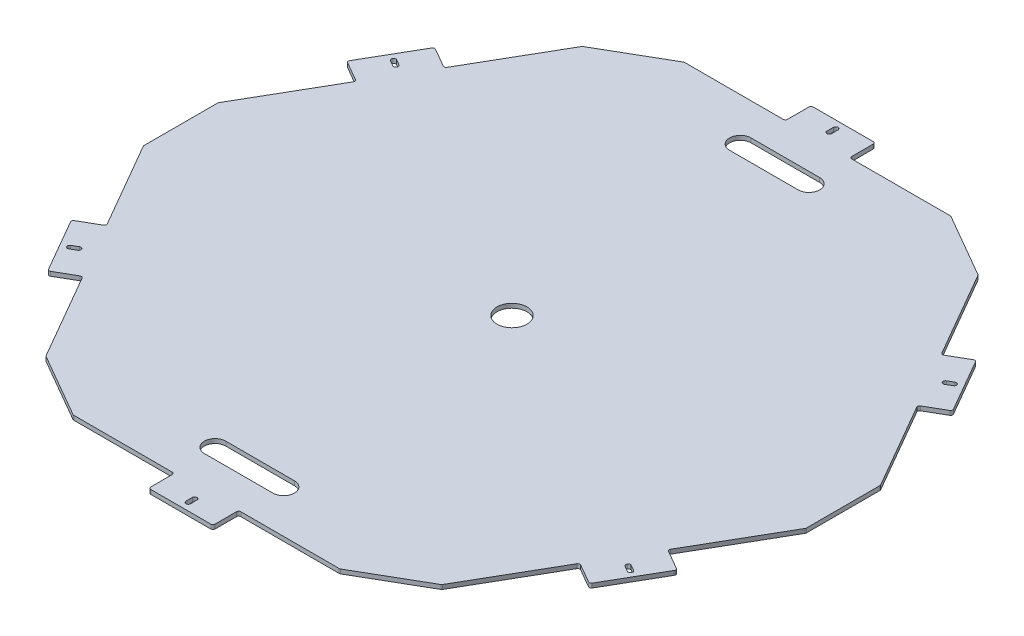
from build123d import *

# Parameters (mm, degrees)
BOSS_EXTRUDE1_DEPTH = 6.35
SKETCH2_R           = 22.225
CUT_EXTRUDE1_DEPTH  = 6.35
FILLET2_R           = 3.175


with BuildPart() as part:
    # Sketch1 → Boss-Extrude1 (new body)
    with BuildSketch(Plane(origin=(0, 0, 0), x_dir=(1, 0, 0), z_dir=(0, 1, 0))):
        Polygon((359.098373018, -359.098373018), (490.5375, -131.439126982), (490.5375, 131.439126982), (359.098373018, 359.098373018), (131.439126982, 490.5375), (-131.439126982, 490.5375), (-359.098373018, 359.098373018), (-490.5375, 131.439126982), (-490.5375, -131.439126982), (-359.098373018, -359.098373018), (-131.439126982, -490.5375), (131.439126982, -490.5375), align=None)
    extrude(amount=BOSS_EXTRUDE1_DEPTH)

    # Sketch2 → Cut-Extrude1 (cut)
    with BuildSketch(Plane(origin=(0, 6.35, 0), x_dir=(1, 0, 0), z_dir=(0, 1, 0))):
        with Locations(Location((0, 0, 0), (0, 0, 270))):
            Circle(SKETCH2_R)
        Polygon((-131.439126982, 490.5375), (-197.430262751, 452.4375), (-47.625, 452.4375), (-47.625, 490.5375), align=None)
        Polygon((131.439126982, 490.5375), (47.625, 490.5375), (47.625, 452.4375), (197.430262751, 452.4375), align=None)
        with BuildLine():
            Line((3.3734375, 479.425), (3.3734375, 469.9))
            ThreePointArc((3.3734375, 469.9), (0, 466.5265625), (-3.3734375, 469.9))
            Line((-3.3734375, 469.9), (-3.3734375, 479.425))
            ThreePointArc((-3.3734375, 479.425), (0, 482.7984375), (3.3734375, 479.425))
        make_face()
        with BuildLine():
            Line((-50.8, 404.8125), (50.8, 404.8125))
            ThreePointArc((50.8, 404.8125), (66.675, 388.9375), (50.8, 373.0625))
            Line((50.8, 373.0625), (-50.8, 373.0625))
            ThreePointArc((-50.8, 373.0625), (-66.675, 388.9375), (-50.8, 404.8125))
        make_face()
        Polygon((401.005436509, 286.513209855), (359.098373018, 359.098373018), (293.107237249, 397.198373018), (368.009868625, 267.463209855), align=None)
        Polygon((490.5375, 55.239126982), (490.5375, 131.439126982), (448.630436509, 204.024290145), (415.634868625, 184.974290145), align=None)
        Polygon((448.630436509, -204.024290145), (490.5375, -131.439126982), (490.5375, -55.239126982), (415.634868625, -184.974290145), align=None)
        Polygon((293.107237249, -397.198373018), (359.098373018, -359.098373018), (401.005436509, -286.513209855), (368.009868625, -267.463209855), align=None)
        Polygon((47.625, -490.5375), (131.439126982, -490.5375), (197.430262751, -452.4375), (47.625, -452.4375), align=None)
        Polygon((-197.430262751, -452.4375), (-131.439126982, -490.5375), (-47.625, -490.5375), (-47.625, -452.4375), align=None)
        Polygon((-401.005436509, -286.513209855), (-359.098373018, -359.098373018), (-293.107237249, -397.198373018), (-368.009868625, -267.463209855), align=None)
        Polygon((-490.5375, -55.239126982), (-490.5375, -131.439126982), (-448.630436509, -204.024290145), (-415.634868625, -184.974290145), align=None)
        Polygon((-448.630436509, 204.024290145), (-490.5375, 131.439126982), (-490.5375, 55.239126982), (-415.634868625, 184.974290145), align=None)
        Polygon((-293.107237249, 397.198373018), (-359.098373018, 359.098373018), (-401.005436509, 286.513209855), (-368.009868625, 267.463209855), align=None)
        with BuildLine():
            Line((-413.507510459, 242.633982573), (-405.258618488, 237.871482573))
            ThreePointArc((-405.258618488, 237.871482573), (-404.023854665, 233.26328125), (-408.632055988, 232.028517427))
            Line((-408.632055988, 232.028517427), (-416.880947959, 236.791017427))
            ThreePointArc((-416.880947959, 236.791017427), (-418.115711782, 241.39921875), (-413.507510459, 242.633982573))
        make_face()
        with BuildLine():
            Line((416.880947959, 236.791017427), (408.632055988, 232.028517427))
            ThreePointArc((408.632055988, 232.028517427), (404.023854665, 233.26328125), (405.258618488, 237.871482573))
            Line((405.258618488, 237.871482573), (413.507510459, 242.633982573))
            ThreePointArc((413.507510459, 242.633982573), (418.115711782, 241.39921875), (416.880947959, 236.791017427))
        make_face()
        with BuildLine():
            Line((416.880947959, -236.791017427), (408.632055988, -232.028517427))
            ThreePointArc((408.632055988, -232.028517427), (404.023854665, -233.26328125), (405.258618488, -237.871482573))
            Line((405.258618488, -237.871482573), (413.507510459, -242.633982573))
            ThreePointArc((413.507510459, -242.633982573), (418.115711782, -241.39921875), (416.880947959, -236.791017427))
        make_face()
        with BuildLine():
            Line((-50.8, -404.8125), (50.8, -404.8125))
            ThreePointArc((50.8, -404.8125), (66.675, -388.9375), (50.8, -373.0625))
            Line((50.8, -373.0625), (-50.8, -373.0625))
            ThreePointArc((-50.8, -373.0625), (-66.675, -388.9375), (-50.8, -404.8125))
        make_face()
        with BuildLine():
            Line((3.3734375, -479.425), (3.3734375, -469.9))
            ThreePointArc((3.3734375, -469.9), (0, -466.5265625), (-3.3734375, -469.9))
            Line((-3.3734375, -469.9), (-3.3734375, -479.425))
            ThreePointArc((-3.3734375, -479.425), (0, -482.7984375), (3.3734375, -479.425))
        make_face()
        with BuildLine():
            Line((-413.507510459, -242.633982573), (-405.258618488, -237.871482573))
            ThreePointArc((-405.258618488, -237.871482573), (-404.023854665, -233.26328125), (-408.632055988, -232.028517427))
            Line((-408.632055988, -232.028517427), (-416.880947959, -236.791017427))
            ThreePointArc((-416.880947959, -236.791017427), (-418.115711782, -241.39921875), (-413.507510459, -242.633982573))
        make_face()
    extrude(amount=-CUT_EXTRUDE1_DEPTH, mode=Mode.SUBTRACT)

    # Fillet2
    fillet2_edges = [part.edges().sort_by_distance(p)[0] for p in [
        (-47.625, 3.175, 490.5375),
        (-197.430262751, 3.175, 452.4375),
        (-47.625, 3.175, 452.4375),
        (-293.107237249, 3.175, 397.198373018),
        (-401.005436509, 3.175, 286.513209855),
        (-368.009868625, 3.175, 267.463209855),
        (-448.630436509, 3.175, 204.024290145),
        (-490.5375, 3.175, 55.239126982),
        (-415.634868625, 3.175, 184.974290145),
        (-490.5375, 3.175, -55.239126982),
        (-448.630436509, 3.175, -204.024290145),
        (-415.634868625, 3.175, -184.974290145),
        (-401.005436509, 3.175, -286.513209855),
        (-293.107237249, 3.175, -397.198373018),
        (-368.009868625, 3.175, -267.463209855),
        (197.430262751, 3.175, 452.4375),
        (47.625, 3.175, 490.5375),
        (47.625, 3.175, 452.4375),
        (401.005436509, 3.175, 286.513209855),
        (293.107237249, 3.175, 397.198373018),
        (368.009868625, 3.175, 267.463209855),
        (490.5375, 3.175, 55.239126982),
        (448.630436509, 3.175, 204.024290145),
        (415.634868625, 3.175, 184.974290145),
        (448.630436509, 3.175, -204.024290145),
        (490.5375, 3.175, -55.239126982),
        (415.634868625, 3.175, -184.974290145),
        (293.107237249, 3.175, -397.198373018),
        (401.005436509, 3.175, -286.513209855),
        (368.009868625, 3.175, -267.463209855),
        (197.430262751, 3.175, -452.4375),
        (47.625, 3.175, -452.4375),
        (47.625, 3.175, -490.5375),
        (-47.625, 3.175, -490.5375),
        (-47.625, 3.175, -452.4375),
        (-197.430262751, 3.175, -452.4375),
    ]]
    fillet(fillet2_edges, radius=FILLET2_R)


solid = part.part
